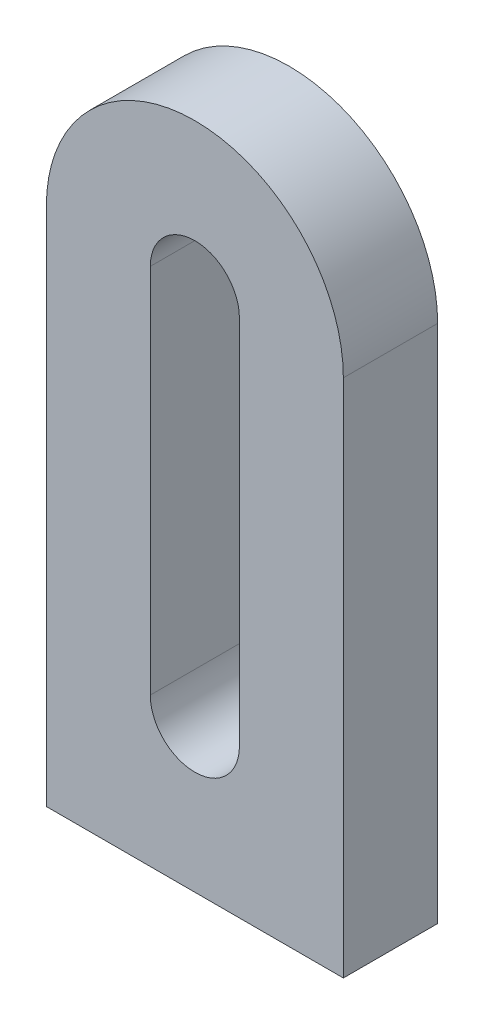
from build123d import *

# Parameters (mm, degrees)
BOSS_EXTRUDE1_DEPTH = 6.35


with BuildPart() as part:
    # Sketch1 → Boss-Extrude1 (new body)
    with BuildSketch(Plane.XY):
        with BuildLine():
            Line((-10, 35), (-10, 0))
            Line((-10, 0), (10, 0))
            Line((10, 0), (10, 35))
            ThreePointArc((10, 35), (0, 45), (-10, 35))
        make_face()
        with BuildLine():
            Line((3, 35), (3, 10))
            ThreePointArc((3, 10), (0, 7), (-3, 10))
            Line((-3, 10), (-3, 35))
            ThreePointArc((-3, 35), (0, 38), (3, 35))
        make_face(mode=Mode.SUBTRACT)
    extrude(amount=BOSS_EXTRUDE1_DEPTH)


solid = part.part
